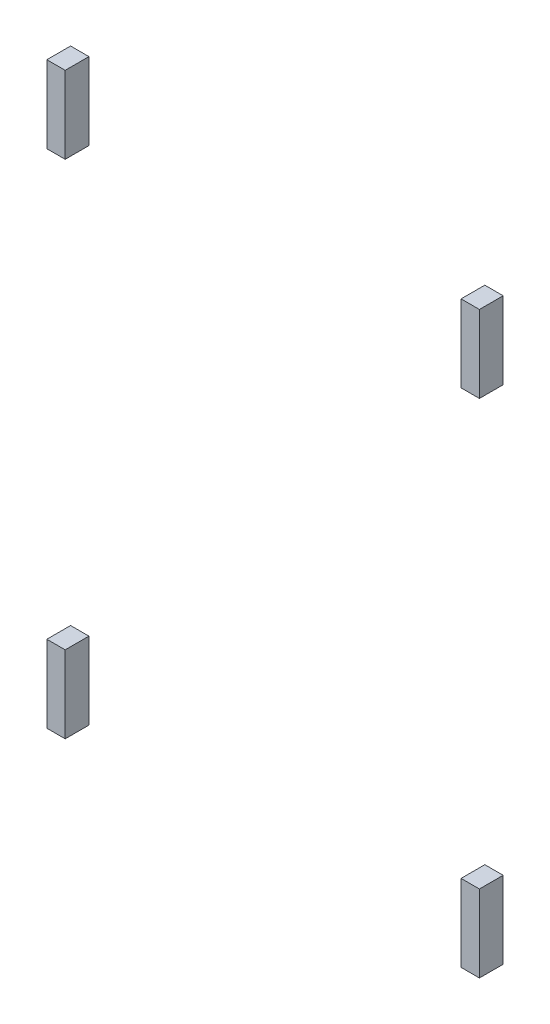
from build123d import *

# Parameters (mm, degrees)
SKETCH5_W           = 30.8
SKETCH5_H           = 100
BOSS_EXTRUDE2_DEPTH = 23.8
SKETCH10_W          = 30.8
SKETCH10_H          = 100
BOSS_EXTRUDE3_DEPTH = 23.8
SKETCH15_W          = 30.8
SKETCH15_H          = 100
BOSS_EXTRUDE4_DEPTH = 23.8
SKETCH21_W          = 30.8
SKETCH21_H          = 100
BOSS_EXTRUDE5_DEPTH = 23.8


with BuildPart() as part:
    # Sketch5 → Boss-Extrude2 (new body)
    with BuildSketch(Plane(origin=(280.55, 0, 0), x_dir=(0, 0, -1), z_dir=(1, 0, 0))):
        with Locations((-1986.2, -450)):
            Rectangle(SKETCH5_W, SKETCH5_H)
    extrude(amount=-BOSS_EXTRUDE2_DEPTH)


with BuildPart() as body_2:
    # Sketch10 → Boss-Extrude3 (new body)
    with BuildSketch(Plane(origin=(280.55, 0, 0), x_dir=(0, 0, -1), z_dir=(1, 0, 0))):
        with Locations((-1986.2, 201)):
            Rectangle(SKETCH10_W, SKETCH10_H)
    extrude(amount=-BOSS_EXTRUDE3_DEPTH)


with BuildPart() as body_3:
    # Sketch15 → Boss-Extrude4 (new body)
    with BuildSketch(Plane.ZY.offset(280.55)):
        with Locations((1986.2, -450)):
            Rectangle(SKETCH15_W, SKETCH15_H)
    extrude(amount=-BOSS_EXTRUDE4_DEPTH)


with BuildPart() as body_4:
    # Sketch21 → Boss-Extrude5 (new body)
    with BuildSketch(Plane.ZY.offset(280.55)):
        with Locations((1986.2, 201)):
            Rectangle(SKETCH21_W, SKETCH21_H)
    extrude(amount=-BOSS_EXTRUDE5_DEPTH)


solid = Compound([part.part, body_2.part, body_3.part, body_4.part])
